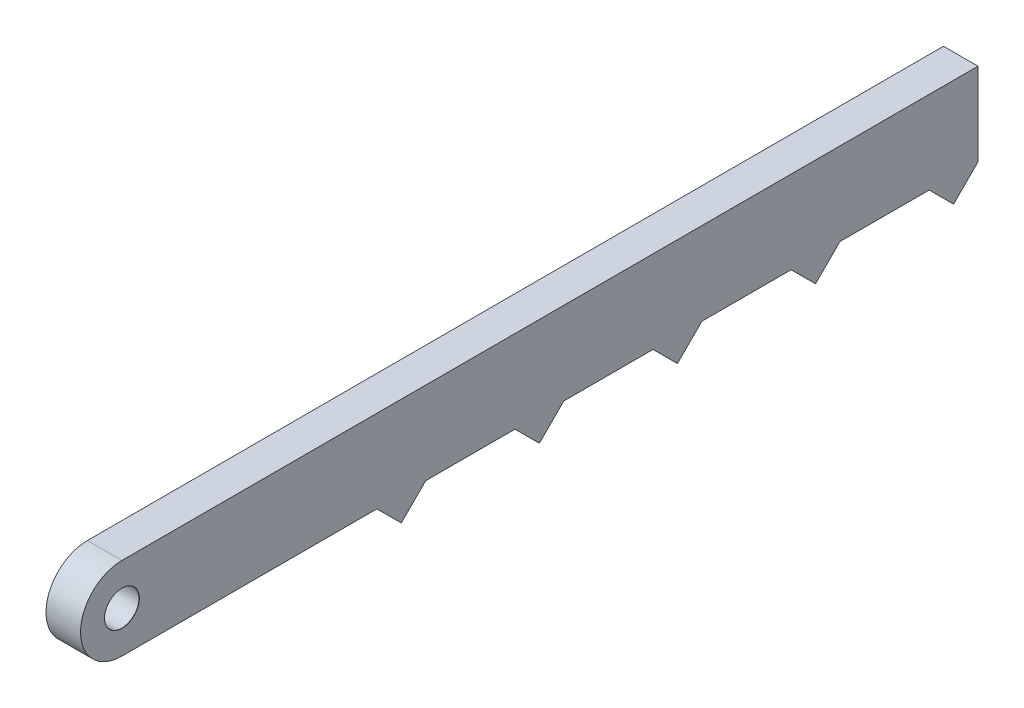
from build123d import *

# Parameters (mm, degrees)
SKETCH1_W                       = 130
SKETCH1_H                       = 12
BOSS_EXTRUDE1_DEPTH             = 5
BOSS_EXTRUDE2_DEPTH             = 5
CUT_EXTRUDE1_DEPTH              = 132.020428994
F_5_0MM_DOWEL_HOLE1_D           = 5
F_5_0MM_DOWEL_HOLE1_CSINK_D     = 5.05
F_5_0MM_DOWEL_HOLE1_CSINK_ANGLE = 90


with BuildPart() as part:
    # Sketch1 → Boss-Extrude1 (new body)
    with BuildSketch(Plane(origin=(0, 0, 0), x_dir=(0, 0, -1), z_dir=(1, 0, 0))):
        with Locations((65, -6)):
            Rectangle(SKETCH1_W, SKETCH1_H)
    extrude(amount=BOSS_EXTRUDE1_DEPTH)

    # Sketch2 → Boss-Extrude2 (add)
    with BuildSketch(Plane(origin=(5, 0, 0), x_dir=(0, 0, -1), z_dir=(1, 0, 0))):
        Polygon((130, -12), (126.464466094, -15.535533906), (122.928932188, -12), align=None)
        Polygon((106.464466094, -15.535533906), (102.928932188, -12), (110, -12), align=None)
        Polygon((86.464466094, -15.535533906), (82.928932188, -12), (90, -12), align=None)
        Polygon((66.464466094, -15.535533906), (62.928932188, -12), (70, -12), align=None)
        Polygon((46.464466094, -15.535533906), (42.928932188, -12), (50, -12), align=None)
    extrude(amount=-BOSS_EXTRUDE2_DEPTH)

    # Sketch5 → Cut-Extrude1 (cut, through all)
    with BuildSketch(Plane(origin=(5, 0, 0), x_dir=(0, 0, -1), z_dir=(1, 0, 0))):
        with BuildLine():
            ThreePointArc((0, -6), (1.757359313, -1.757359313), (6, 0))
            Line((6, 0), (0, 0))
            Line((0, 0), (0, -6))
        make_face()
        with BuildLine():
            ThreePointArc((6, -12), (1.757359313, -10.242640687), (0, -6))
            Line((0, -6), (0, -12))
            Line((0, -12), (6, -12))
        make_face()
    extrude(amount=-CUT_EXTRUDE1_DEPTH, mode=Mode.SUBTRACT)

    # Ø5.0mm Dowel Hole1 (through all)
    with Locations(Plane(origin=(5, 0, 0), x_dir=(0, 0, -1), z_dir=(1, 0, 0))):
        with Locations((6, -6)):
            CounterSinkHole(F_5_0MM_DOWEL_HOLE1_D / 2, F_5_0MM_DOWEL_HOLE1_CSINK_D / 2, counter_sink_angle=F_5_0MM_DOWEL_HOLE1_CSINK_ANGLE)


solid = part.part
